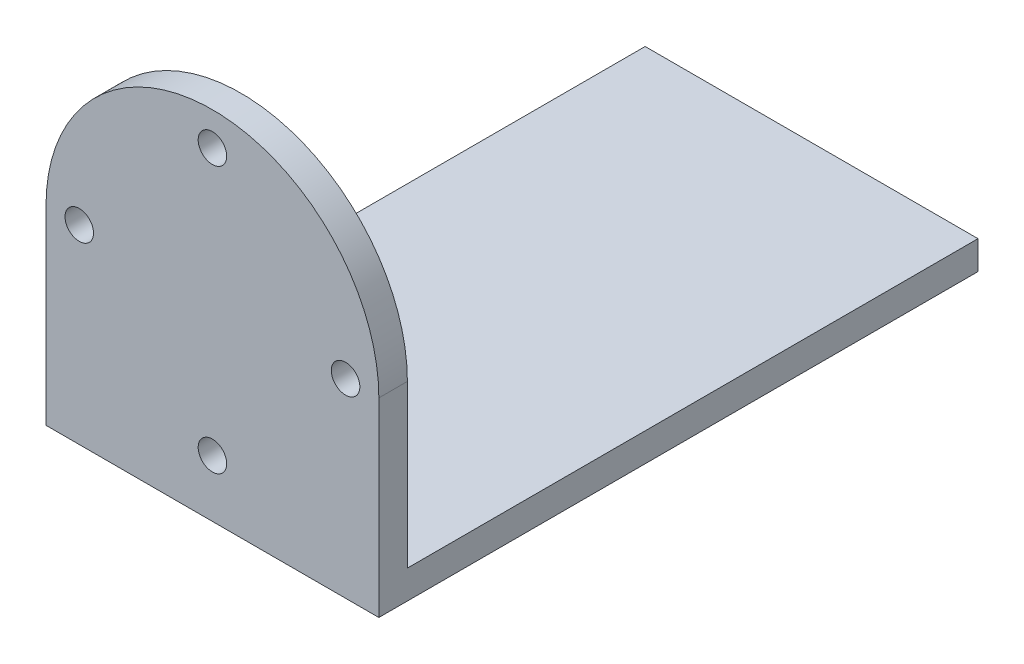
from build123d import *

# Parameters (mm, degrees)
SKETCH1_R           = 1.5
BOSS_EXTRUDE1_DEPTH = 3
SKETCH2_W           = 35
SKETCH2_H           = 3
BOSS_EXTRUDE2_DEPTH = 60


with BuildPart() as part:
    # Sketch1 → Boss-Extrude1 (new body)
    with BuildSketch(Plane.XY):
        with BuildLine():
            Line((-17.5, 0), (-17.5, -20))
            Line((-17.5, -20), (17.5, -20))
            Line((17.5, -20), (17.5, 0))
            ThreePointArc((17.5, 0), (0, 17.5), (-17.5, 0))
        make_face()
        with Locations((0, 14)):
            Circle(SKETCH1_R, mode=Mode.SUBTRACT)
        with Locations((14, 0)):
            Circle(SKETCH1_R, mode=Mode.SUBTRACT)
        with Locations((0, -14)):
            Circle(SKETCH1_R, mode=Mode.SUBTRACT)
        with Locations((-14, 0)):
            Circle(SKETCH1_R, mode=Mode.SUBTRACT)
    extrude(amount=BOSS_EXTRUDE1_DEPTH)

    # Sketch2 → Boss-Extrude2 (add)
    with BuildSketch(Plane(origin=(0, 0, 0), x_dir=(-1, 0, 0), z_dir=(0, 0, -1))):
        with Locations((0, -18.5)):
            Rectangle(SKETCH2_W, SKETCH2_H)
    extrude(amount=BOSS_EXTRUDE2_DEPTH)


solid = part.part
